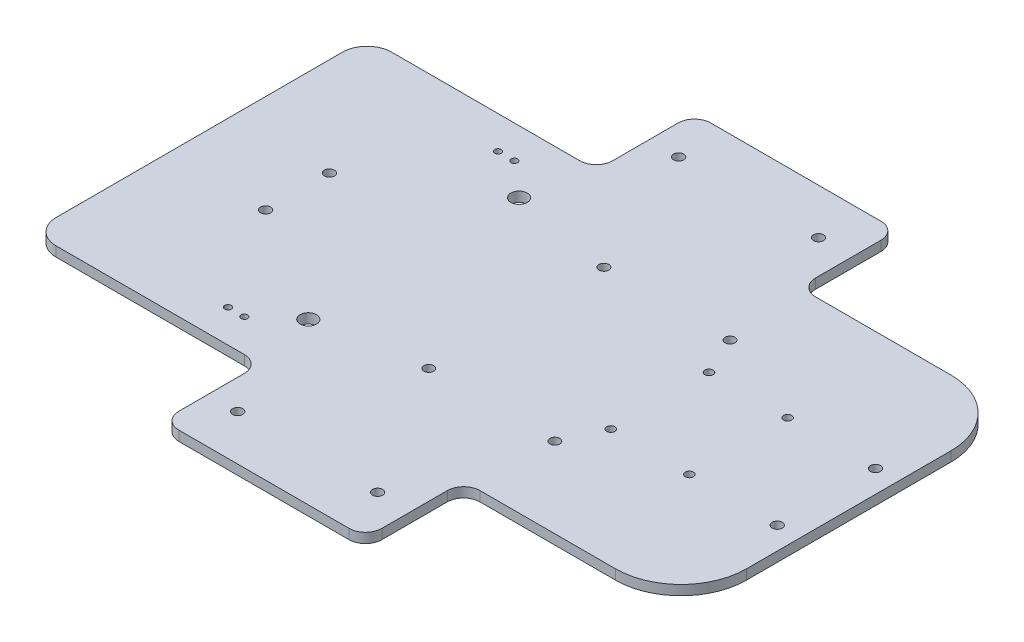
from build123d import *

# Parameters (mm, degrees)
SKETCH_1_R      = 1.5
SKETCH_1_R_2    = 2.5
SKETCH_1_R_3    = 1.55
SKETCH_1_R_4    = 1.25
SKETCH_1_R_5    = 1
EXTRUDE_1_DEPTH = 1.5


with BuildPart() as part:
    # 草图1 → 凸台-拉伸1 (new, symmetric)
    with BuildSketch(Plane(origin=(0, 0, 0), x_dir=(1, 0, 0), z_dir=(0, 1, 0))):
        with BuildLine():
            Line((132, -5), (132, -25))
            ThreePointArc((132, -25), (130.535533906, -28.535533906), (127, -30))
            Line((127, -30), (75, -30))
            ThreePointArc((75, -30), (71.464466094, -28.535533906), (70, -25))
            Line((70, -25), (70, -5))
            ThreePointArc((70, -5), (68.535533906, -1.464466094), (65, 0))
            Line((65, 0), (7.5, 0))
            ThreePointArc((7.5, 0), (2.196699141, 2.196699141), (0, 7.5))
            Line((0, 7.5), (0, 95))
            ThreePointArc((0, 95), (2.196699141, 100.303300859), (7.5, 102.5))
            Line((7.5, 102.5), (65, 102.5))
            ThreePointArc((65, 102.5), (68.535533906, 103.964466094), (70, 107.5))
            Line((70, 107.5), (70, 127.5))
            ThreePointArc((70, 127.5), (71.464466094, 131.035533906), (75, 132.5))
            Line((75, 132.5), (127, 132.5))
            ThreePointArc((127, 132.5), (130.535533906, 131.035533906), (132, 127.5))
            Line((132, 127.5), (132, 107.5))
            ThreePointArc((132, 107.5), (133.464466094, 103.964466094), (137, 102.5))
            Line((137, 102.5), (178.395701384, 102.5))
            ThreePointArc((178.395701384, 102.5), (192.537837007, 96.642135624), (198.395701384, 82.5))
            Line((198.395701384, 82.5), (198.395701384, 20))
            ThreePointArc((198.395701384, 20), (192.537837007, 5.857864376), (178.395701384, 0))
            Line((178.395701384, 0), (137, 0))
            ThreePointArc((137, 0), (133.464466094, -1.464466094), (132, -5))
        make_face()
        with Locations(Location((96.855482095, 24.5, 0), (0, 0, 270))):
            Circle(SKETCH_1_R, mode=Mode.SUBTRACT)
        with Locations(Location((135.355482095, 24.5, 0), (0, 0, 270))):
            Circle(SKETCH_1_R, mode=Mode.SUBTRACT)
        with Locations(Location((65.477875917, 19.059382071, 0), (0, 0, 270))):
            Circle(SKETCH_1_R_2, mode=Mode.SUBTRACT)
        with Locations(Location((30, 41.5, 0), (0, 0, 270))):
            Circle(SKETCH_1_R_3, mode=Mode.SUBTRACT)
        with Locations(Location((140.705086193, 36.25, 0), (0, 0, 270))):
            Circle(SKETCH_1_R_4, mode=Mode.SUBTRACT)
        with Locations(Location((164.705086193, 36.25, 0), (0, 0, 270))):
            Circle(SKETCH_1_R_4, mode=Mode.SUBTRACT)
        with Locations(Location((79.074216313, -16.098364995, 0), (0, 0, 270))):
            Circle(SKETCH_1_R_3, mode=Mode.SUBTRACT)
        with Locations(Location((121.803446989, -16.098364995, 0), (0, 0, 270))):
            Circle(SKETCH_1_R_3, mode=Mode.SUBTRACT)
        with Locations(Location((50, 10, 0), (0, 0, 270))):
            Circle(SKETCH_1_R_5, mode=Mode.SUBTRACT)
        with Locations(Location((164.705086193, 66.25, 0), (0, 0, 90))):
            Circle(SKETCH_1_R_4, mode=Mode.SUBTRACT)
        with Locations(Location((140.705086193, 66.25, 0), (0, 0, 90))):
            Circle(SKETCH_1_R_4, mode=Mode.SUBTRACT)
        with Locations(Location((135.355482095, 78, 0), (0, 0, 90))):
            Circle(SKETCH_1_R, mode=Mode.SUBTRACT)
        with Locations(Location((96.855482095, 78, 0), (0, 0, 90))):
            Circle(SKETCH_1_R, mode=Mode.SUBTRACT)
        with Locations(Location((65.477875917, 83.440617929, 0), (0, 0, 90))):
            Circle(SKETCH_1_R_2, mode=Mode.SUBTRACT)
        with Locations(Location((50, 92.5, 0), (0, 0, 90))):
            Circle(SKETCH_1_R_5, mode=Mode.SUBTRACT)
        with Locations(Location((30, 61, 0), (0, 0, 90))):
            Circle(SKETCH_1_R_3, mode=Mode.SUBTRACT)
        with Locations(Location((55, 10, 0), (0, 0, 270))):
            Circle(SKETCH_1_R_5, mode=Mode.SUBTRACT)
        with Locations(Location((55, 92.5, 0), (0, 0, 90))):
            Circle(SKETCH_1_R_5, mode=Mode.SUBTRACT)
        with Locations(Location((121.803446989, 118.598364995, 0), (0, 0, 90))):
            Circle(SKETCH_1_R_3, mode=Mode.SUBTRACT)
        with Locations(Location((79.074216313, 118.598364995, 0), (0, 0, 90))):
            Circle(SKETCH_1_R_3, mode=Mode.SUBTRACT)
        with Locations(Location((191.545701384, 36.25, 0), (0, 0, 270))):
            Circle(SKETCH_1_R_3, mode=Mode.SUBTRACT)
        with Locations(Location((191.545701384, 66.25, 0), (0, 0, 90))):
            Circle(SKETCH_1_R_3, mode=Mode.SUBTRACT)
    extrude(amount=EXTRUDE_1_DEPTH, both=True)


solid = part.part
